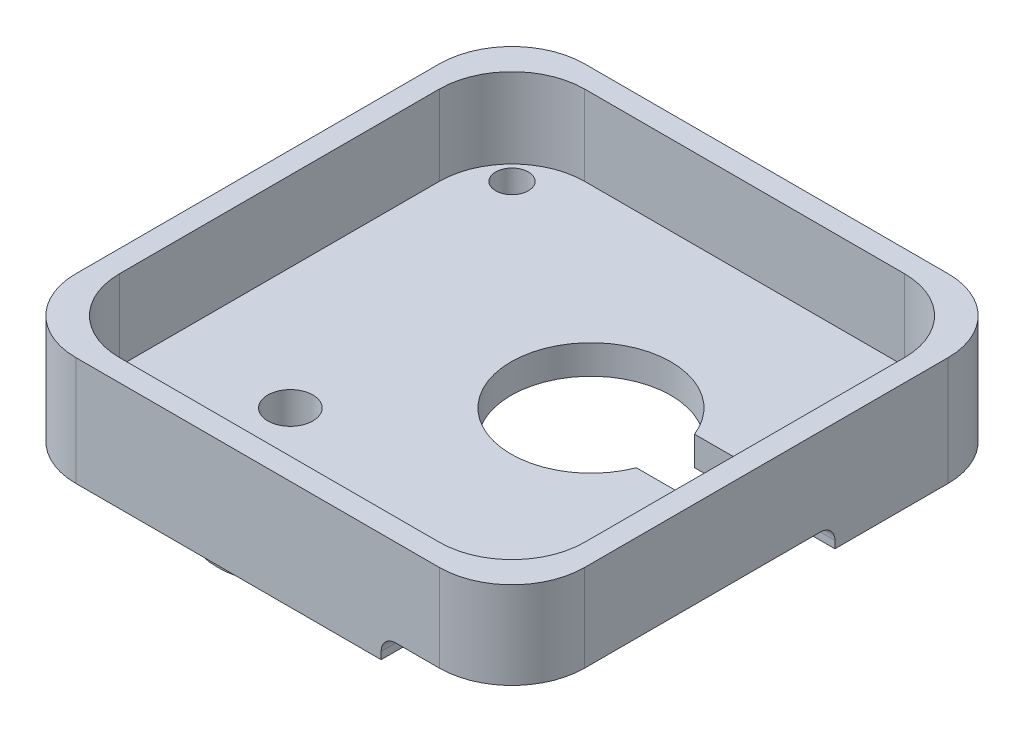
from build123d import *

# Parameters (mm, degrees)
SKETCH1_R           = 2.5
BOSS_EXTRUDE2_DEPTH = 4
BOSS_EXTRUDE3_DEPTH = 11
SKETCH3_R           = 3.1
CUT_EXTRUDE1_DEPTH  = 8.5
BOSS_EXTRUDE4_START = 10
SKETCH4_R           = 10
SKETCH4_R_2         = 3.1
BOSS_EXTRUDE4_DEPTH = 10
SKETCH5_W           = 5.8
SKETCH5_H           = 2.8
CUT_EXTRUDE2_DEPTH  = 8.8
SKETCH7_R           = 1.6
CUT_EXTRUDE3_DEPTH  = 10
SKETCH13_R          = 11
CUT_EXTRUDE6_DEPTH  = 10
SKETCH14_R          = 2.25
CUT_EXTRUDE7_DEPTH  = 10
CUT_EXTRUDE8_DEPTH  = 10
SKETCH16_W          = 18
SKETCH16_H          = 44.43287335
CUT_EXTRUDE9_DEPTH  = 3
FILLET1_R           = 2


with BuildPart() as part:
    # Sketch1 → Boss-Extrude2 (new body)
    with BuildSketch(Plane(origin=(0, 0, 0), x_dir=(1, 0, 0), z_dir=(0, 1, 0))):
        with BuildLine():
            Line((-10, 0), (-60, 0))
            ThreePointArc((-60, 0), (-67.071067812, 2.928932188), (-70, 10))
            Line((-70, 10), (-70, 60))
            ThreePointArc((-70, 60), (-67.071067812, 67.071067812), (-60, 70))
            Line((-60, 70), (-10, 70))
            ThreePointArc((-10, 70), (-2.928932188, 67.071067812), (0, 60))
            Line((0, 60), (0, 10))
            ThreePointArc((0, 10), (-2.928932188, 2.928932188), (-10, 0))
        make_face()
        with Locations(Location((-50.25, 19.75, 0), (0, 0, 270))):
            Circle(SKETCH1_R, mode=Mode.SUBTRACT)
        with Locations(Location((-29.56712665, 40.43287335, 0), (0, 0, 270))):
            Circle(SKETCH1_R, mode=Mode.SUBTRACT)
    extrude(amount=BOSS_EXTRUDE2_DEPTH)

    # Sketch2 → Boss-Extrude3 (add)
    with BuildSketch(Plane(origin=(0, 4, 0), x_dir=(1, 0, 0), z_dir=(0, 1, 0))):
        with BuildLine():
            Line((-10, 0), (-60, 0))
            ThreePointArc((-60, 0), (-67.071067812, 2.928932188), (-70, 10))
            Line((-70, 10), (-70, 60))
            ThreePointArc((-70, 60), (-67.071067812, 67.071067812), (-60, 70))
            Line((-60, 70), (-10, 70))
            ThreePointArc((-10, 70), (-2.928932188, 67.071067812), (0, 60))
            Line((0, 60), (0, 10))
            ThreePointArc((0, 10), (-2.928932188, 2.928932188), (-10, 0))
        make_face()
        with BuildLine():
            Line((-3, 13), (-3, 57))
            ThreePointArc((-3, 57), (-5.928932188, 64.071067812), (-13, 67))
            Line((-13, 67), (-57, 67))
            ThreePointArc((-57, 67), (-64.071067812, 64.071067812), (-67, 57))
            Line((-67, 57), (-67, 13))
            ThreePointArc((-67, 13), (-64.071067812, 5.928932188), (-57, 3))
            Line((-57, 3), (-13, 3))
            ThreePointArc((-13, 3), (-5.928932188, 5.928932188), (-3, 13))
        make_face(mode=Mode.SUBTRACT)
    extrude(amount=BOSS_EXTRUDE3_DEPTH)

    # Sketch3 → Cut-Extrude1 (cut)
    with BuildSketch(Plane.XZ):
        with Locations(Location((-50.25, -19.75, 0), (0, 0, 270))):
            Circle(SKETCH3_R)
    extrude(amount=-CUT_EXTRUDE1_DEPTH, mode=Mode.SUBTRACT)

    # Sketch4 → Boss-Extrude4 (add)
    with BuildSketch(Plane.XZ.offset(BOSS_EXTRUDE4_START)):
        with Locations(Location((-50.25, -19.75, 0), (0, 0, 90))):
            Circle(SKETCH4_R)
        with Locations(Location((-50.25, -19.75, 0), (0, 0, 270))):
            Circle(SKETCH4_R_2, mode=Mode.SUBTRACT)
    extrude(amount=-BOSS_EXTRUDE4_DEPTH)

    # Sketch5 → Cut-Extrude2 (cut)
    with BuildSketch(Plane.XZ.offset(10)):
        with Locations((-50.25, -13.25)):
            Rectangle(SKETCH5_W, SKETCH5_H)
    extrude(amount=-CUT_EXTRUDE2_DEPTH, mode=Mode.SUBTRACT)

    # Sketch7 → Cut-Extrude3 (cut)
    with BuildSketch(Plane(origin=(-50.25, -10, -9.75), x_dir=(1, 0, 0), z_dir=(0, 0, 1))):
        with Locations((0, 5)):
            Circle(SKETCH7_R)
    extrude(amount=-CUT_EXTRUDE3_DEPTH, mode=Mode.SUBTRACT)

    # Sketch13 → Cut-Extrude6 (cut)
    with BuildSketch(Plane.XZ):
        with Locations(Location((-29.56712665, -40.43287335, 0), (0, 0, 270))):
            Circle(SKETCH13_R)
    extrude(amount=-CUT_EXTRUDE6_DEPTH, mode=Mode.SUBTRACT)

    # Sketch14 → Cut-Extrude7 (cut)
    with BuildSketch(Plane(origin=(0, 4, 0), x_dir=(1, 0, 0), z_dir=(0, 1, 0))):
        with Locations(Location((-8, 62, 0), (0, 0, 270))):
            Circle(SKETCH14_R)
        with Locations(Location((-62, 62, 0), (0, 0, 270))):
            Circle(SKETCH14_R)
        with Locations(Location((-62, 8, 0), (0, 0, 270))):
            Circle(SKETCH14_R)
        with Locations(Location((-8, 8, 0), (0, 0, 270))):
            Circle(SKETCH14_R)
    extrude(amount=-CUT_EXTRUDE7_DEPTH, mode=Mode.SUBTRACT)

    # Sketch15 → Cut-Extrude8 (cut)
    with BuildSketch(Plane.XZ):
        with BuildLine():
            ThreePointArc((-19.320175884, -36.43287335), (-18.757028167, -38.397739254), (-18.56712665, -40.43287335))
            Line((-18.56712665, -40.43287335), (-11.56712665, -40.43287335))
            ThreePointArc((-11.56712665, -40.43287335), (-11.679998346, -38.420252912), (-12.017197876, -36.43287335))
            Line((-12.017197876, -36.43287335), (-19.320175884, -36.43287335))
        make_face()
        with BuildLine():
            Line((-11.56712665, -40.43287335), (-18.56712665, -40.43287335))
            ThreePointArc((-18.56712665, -40.43287335), (-18.757028167, -42.468007445), (-19.320175884, -44.43287335))
            Line((-19.320175884, -44.43287335), (-12.017197876, -44.43287335))
            ThreePointArc((-12.017197876, -44.43287335), (-11.679998346, -42.445493788), (-11.56712665, -40.43287335))
        make_face()
    extrude(amount=-CUT_EXTRUDE8_DEPTH, mode=Mode.SUBTRACT)

    # Sketch16 → Cut-Extrude9 (cut)
    with BuildSketch(Plane.XZ):
        with Locations((-9, -22.216436675)):
            Rectangle(SKETCH16_W, SKETCH16_H)
    extrude(amount=-CUT_EXTRUDE9_DEPTH, mode=Mode.SUBTRACT)

    # Fillet1
    fillet1_edges = [part.edges().sort_by_distance(p)[0] for p in [
        (-6.008598938, 3, -44.43287335),
        (-18, 3, -18.216436675),
    ]]
    fillet(fillet1_edges, radius=FILLET1_R)


solid = part.part
